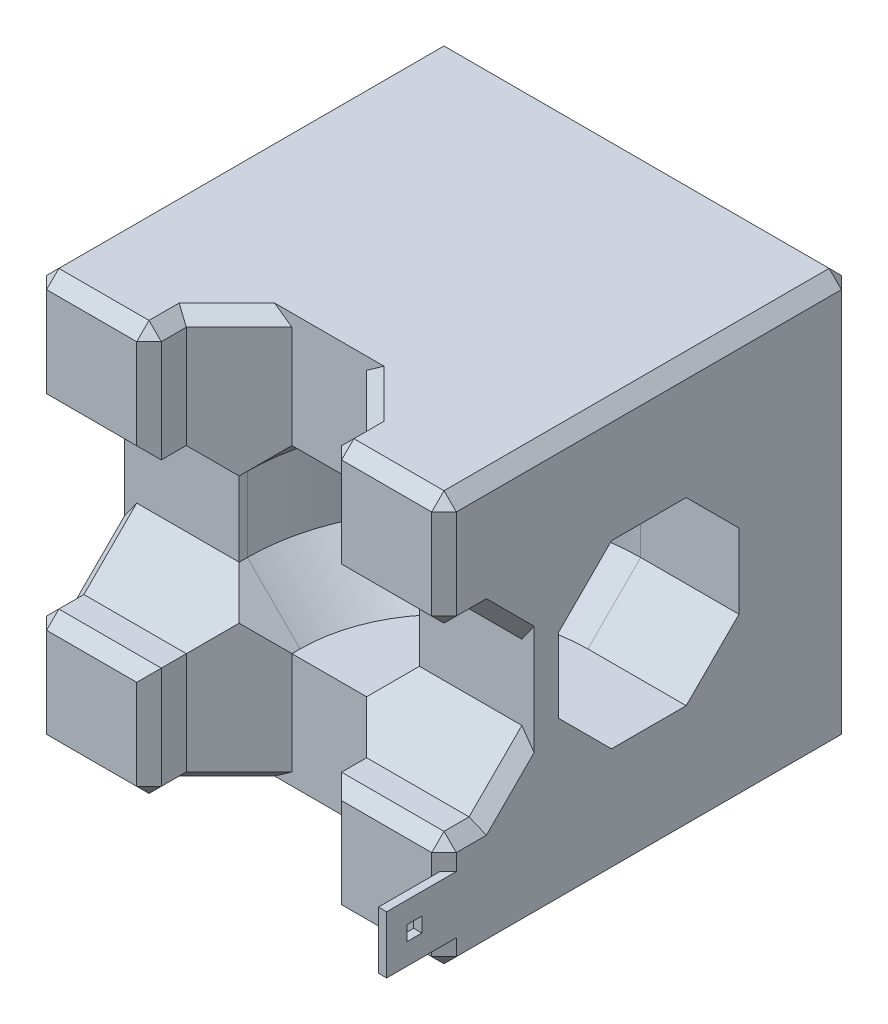
from build123d import *

# Parameters (mm, degrees)
SKETCH1_W                = 50
SKETCH1_H                = 50
BOSS_EXTRUDE1_DEPTH      = 50
CUT_EXTRUDE3_DEPTH       = 87.602540378
CUT_EXTRUDE4_DEPTH       = 87.602540378
CHAMFER1_SIZE            = 1.5
BOSS_EXTRUDE2_DEPTH      = 7
BOSS_EXTRUDE2_DEPTH_BACK = 10
SKETCH10_W               = 1
SKETCH10_H               = 7
SKETCH11_W               = 1.8
SKETCH11_H               = 1.8
CUT_EXTRUDE5_DEPTH       = 7


with BuildPart() as part:
    # Sketch1 → Boss-Extrude1 (new body)
    with BuildSketch(Plane.XY):
        with Locations((25, 25)):
            Rectangle(SKETCH1_W, SKETCH1_H)
    extrude(amount=BOSS_EXTRUDE1_DEPTH)

    # Sketch2 → Cut-Extrude3 (cut, through all)
    with BuildSketch(Plane.ZX):
        Polygon((61, 29.556349186), (54.556349186, 36), (45.443650814, 36), (39, 29.556349186), (39, 20.443650814), (45.443650814, 14), (54.556349186, 14), (61, 20.443650814), align=None)
    extrude(amount=CUT_EXTRUDE3_DEPTH, mode=Mode.SUBTRACT)

    # Sketch6 → Cut-Extrude4 (cut, through all)
    with BuildSketch(Plane(origin=(0, 0, 0), x_dir=(0, 0, -1), z_dir=(1, 0, 0))):
        Polygon((-61, 29.556349186), (-61, 20.443650814), (-54.556349186, 14), (-45.443650814, 14), (-39, 20.443650814), (-39, 29.556349186), (-45.443650814, 36), (-54.556349186, 36), align=None)
    extrude(amount=CUT_EXTRUDE4_DEPTH, mode=Mode.SUBTRACT)

    # Cut-Sweep5: sweep along a path in Sketch9
    with BuildLine(Plane(origin=(0, 25, 0), x_dir=(-1, 0, 0), z_dir=(0, -1, 0))) as cut_sweep5_path:
        Line((-50, -25), (-38, -25))
        ThreePointArc((-38, -25), (-28.807611845, -28.807611845), (-25, -38))
        Line((-25, -38), (-25, -50))
    # Sketch8 → Cut-Sweep5 (sweep, cut)
    with BuildSketch(Plane(origin=(50, 0, 0), x_dir=(0, 0, -1), z_dir=(1, 0, 0))):
        Polygon((-14, 29.556349186), (-20.443650814, 36), (-29.556349186, 36), (-36, 29.556349186), (-36, 20.443650814), (-29.556349186, 14), (-20.443650814, 14), (-14, 20.443650814), align=None)
    sweep(path=cut_sweep5_path.line, mode=Mode.SUBTRACT)

    # Chamfer1
    chamfer1_edges = [part.edges().sort_by_distance(p)[0] for p in [
        (50, 7, 50),
        (43, 50, 50),
        (43, 0, 50),
        (7, 50, 50),
        (14, 43, 50),
        (36, 7, 50),
        (36, 0, 47.721825407),
        (14, 0, 47.721825407),
        (14, 50, 47.721825407),
        (36, 50, 47.721825407),
        (32.778174593, 50, 42.221825407),
        (17.221825407, 50, 42.221825407),
        (32.778174593, 0, 42.221825407),
        (17.221825407, 0, 42.221825407),
        (0, 43, 50),
        (25, 50, 0),
        (14, 7, 50),
        (50, 25, 0),
        (36, 43, 50),
        (50, 43, 50),
        (25, 0, 0),
        (0, 7, 50),
        (0, 25, 0),
        (50, 36, 47.721825407),
        (50, 14, 47.721825407),
        (50, 17.221825407, 42.221825407),
        (50, 32.778174593, 42.221825407),
        (0, 14, 47.721825407),
        (0, 36, 47.721825407),
        (43, 14, 50),
        (7, 14, 50),
        (0, 17.221825407, 42.221825407),
        (0, 32.778174593, 42.221825407),
        (43, 36, 50),
        (7, 36, 50),
        (7, 0, 50),
        (0, 50, 25),
        (50, 50, 25),
        (50, 0, 25),
        (0, 0, 25),
    ]]
    chamfer(chamfer1_edges, length=CHAMFER1_SIZE)

    # Sketch10 → Boss-Extrude2 (add, two sides: drawn at the far end of the back side and taken through both)
    with BuildSketch(Plane.XY.offset(50).offset(-BOSS_EXTRUDE2_DEPTH_BACK)):
        with Locations((49.5, 7)):
            Rectangle(SKETCH10_W, SKETCH10_H)
    extrude(amount=BOSS_EXTRUDE2_DEPTH + BOSS_EXTRUDE2_DEPTH_BACK)

    # Sketch11 → Cut-Extrude5 (cut)
    with BuildSketch(Plane(origin=(50, 0, 0), x_dir=(0, 0, -1), z_dir=(1, 0, 0))):
        with Locations((-53.6, 7)):
            Rectangle(SKETCH11_W, SKETCH11_H)
    extrude(amount=-CUT_EXTRUDE5_DEPTH, mode=Mode.SUBTRACT)


solid = part.part
